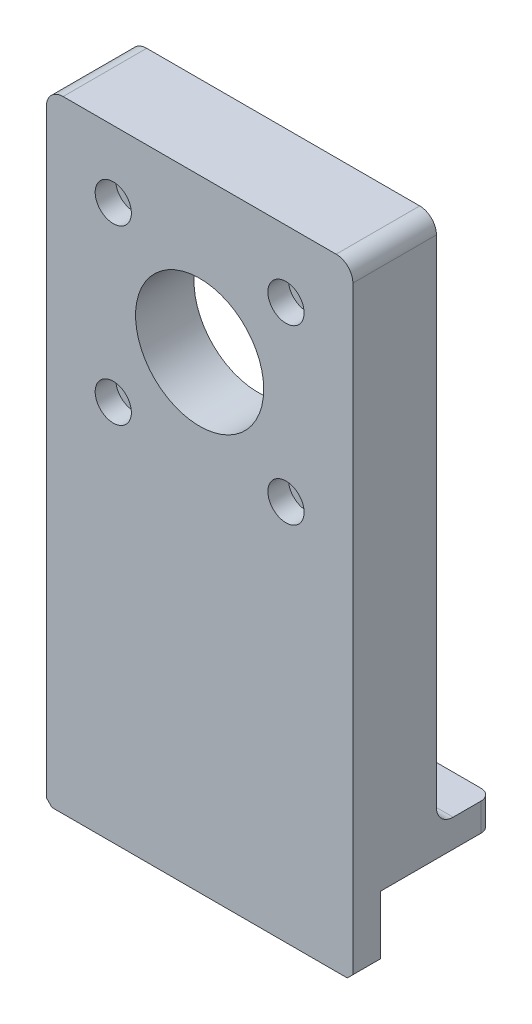
from build123d import *

# Parameters (mm, degrees)
SKICA2_R                                         = 11.5
P_IDAT_VYSUNUT_M1_DEPTH                          = 15
SKICA5_W                                         = 55
SKICA5_H                                         = 5
P_IDAT_VYSUNUT_M4_DEPTH                          = 11.5
ZKOSEN_1_SIZE                                    = 1
SKICA6_W                                         = 43.3
SKICA6_H                                         = 43.3
ODEBRAT_VYSUNUT_M1_DEPTH                         = 4.5
V_LCOV_ZAHLOUBEN_PRO_M3_ROUBY_S_VNIT_D           = 3.5
V_LCOV_ZAHLOUBEN_PRO_M3_ROUBY_S_VNIT_CBORE_D     = 6.5
V_LCOV_ZAHLOUBEN_PRO_M3_ROUBY_S_VNIT_CBORE_DEPTH = 3.7
SKICA10_W                                        = 55
SKICA10_H                                        = 5
P_IDAT_VYSUNUT_M5_DEPTH                          = 10
ZAOBLIT1_R                                       = 2
ZAOBLIT2_R                                       = 3


with BuildPart() as part:
    # Skica2 → Přidat vysunutím1 (new body)
    with BuildSketch(Plane.XY):
        with BuildLine():
            Line((-27.5, 24.5), (-27.5, -72.5))
            Line((-27.5, -72.5), (27.5, -72.5))
            Line((27.5, -72.5), (27.5, 24.5))
            ThreePointArc((27.5, 24.5), (26.621320344, 26.621320344), (24.5, 27.5))
            Line((24.5, 27.5), (-24.5, 27.5))
            ThreePointArc((-24.5, 27.5), (-26.621320344, 26.621320344), (-27.5, 24.5))
        make_face()
        Circle(SKICA2_R, mode=Mode.SUBTRACT)
    extrude(amount=-P_IDAT_VYSUNUT_M1_DEPTH)

    # Skica5 → Přidat vysunutím4 (add)
    with BuildSketch(Plane.XZ.offset(72.5)):
        with Locations((0, -2.5)):
            Rectangle(SKICA5_W, SKICA5_H)
    extrude(amount=P_IDAT_VYSUNUT_M4_DEPTH)

    # Zkosení1
    zkosen_1_edges = [part.edges().sort_by_distance(p)[0] for p in [
        (-27.5, -84, -2.5),
        (27.5, -84, -2.5),
    ]]
    chamfer(zkosen_1_edges, length=ZKOSEN_1_SIZE)

    # Skica6 → Odebrat vysunutím1 (cut)
    with BuildSketch(Plane(origin=(0, 0, -15), x_dir=(-1, 0, 0), z_dir=(0, 0, -1))):
        Rectangle(SKICA6_W, SKICA6_H)
    extrude(amount=-ODEBRAT_VYSUNUT_M1_DEPTH, mode=Mode.SUBTRACT)

    # Válcové zahloubení pro M3 šrouby s vnitřním šestihranem1 (through all)
    with Locations(Plane.XY):
        with Locations((15.5, 15.5), (-15.5, -15.5), (-15.5, 15.5), (15.5, -15.5)):
            CounterBoreHole(V_LCOV_ZAHLOUBEN_PRO_M3_ROUBY_S_VNIT_D / 2, V_LCOV_ZAHLOUBEN_PRO_M3_ROUBY_S_VNIT_CBORE_D / 2, V_LCOV_ZAHLOUBEN_PRO_M3_ROUBY_S_VNIT_CBORE_DEPTH)

    # Skica10 → Přidat vysunutím5 (add)
    with BuildSketch(Plane(origin=(0, 0, -15), x_dir=(-1, 0, 0), z_dir=(0, 0, -1))):
        with Locations((0, -70)):
            Rectangle(SKICA10_W, SKICA10_H)
    extrude(amount=P_IDAT_VYSUNUT_M5_DEPTH)

    # Zaoblit1
    zaoblit1_edges = [part.edges().sort_by_distance(p)[0] for p in [
        (27.5, -70, -25),
        (-27.5, -70, -25),
    ]]
    fillet(zaoblit1_edges, radius=ZAOBLIT1_R)

    # Zaoblit2
    zaoblit2_edges = [part.edges().sort_by_distance(p)[0] for p in [
        (0, -67.5, -15),
    ]]
    fillet(zaoblit2_edges, radius=ZAOBLIT2_R)


solid = part.part
